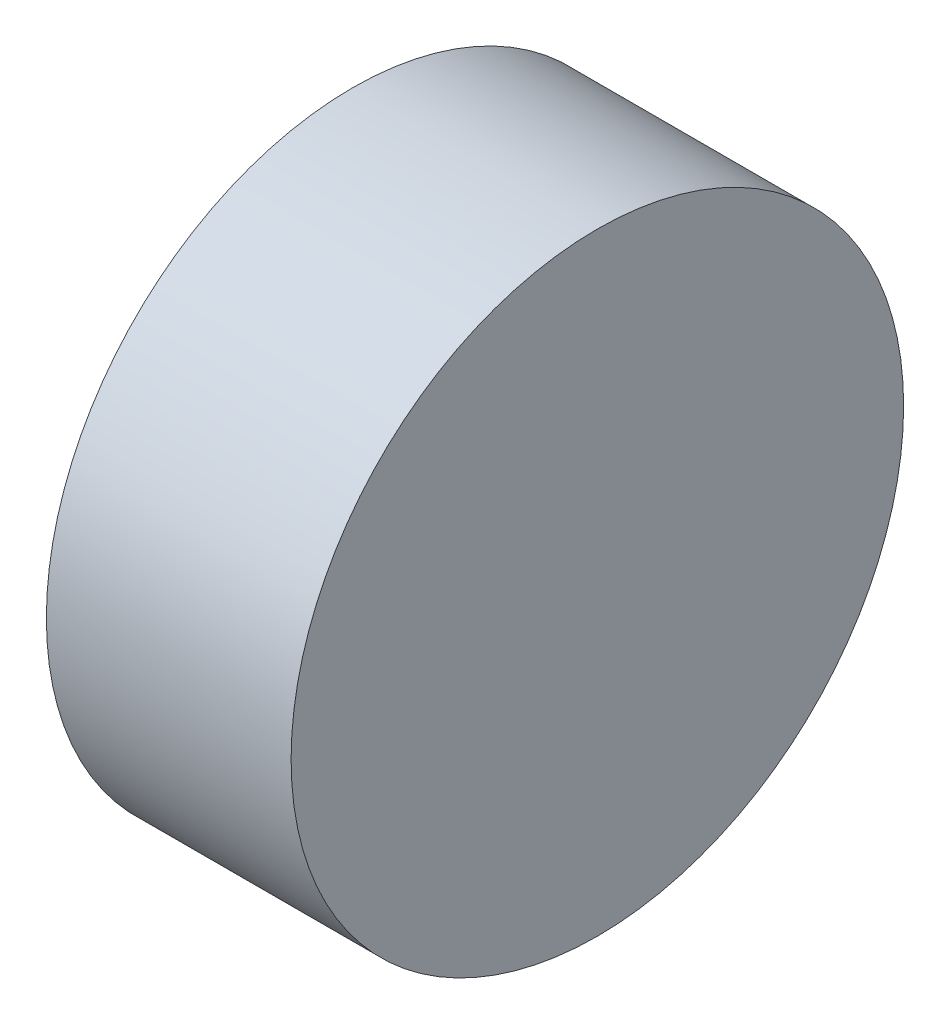
from build123d import *

# Parameters (mm, degrees)
SKETCH2_R           = 21.4
BOSS_EXTRUDE1_DEPTH = 17.1


with BuildPart() as part:
    # Sketch2 → Boss-Extrude1 (new body)
    with BuildSketch(Plane(origin=(0, 0, 0), x_dir=(0, 0, -1), z_dir=(1, 0, 0))):
        Circle(SKETCH2_R)
    extrude(amount=BOSS_EXTRUDE1_DEPTH)


solid = part.part
